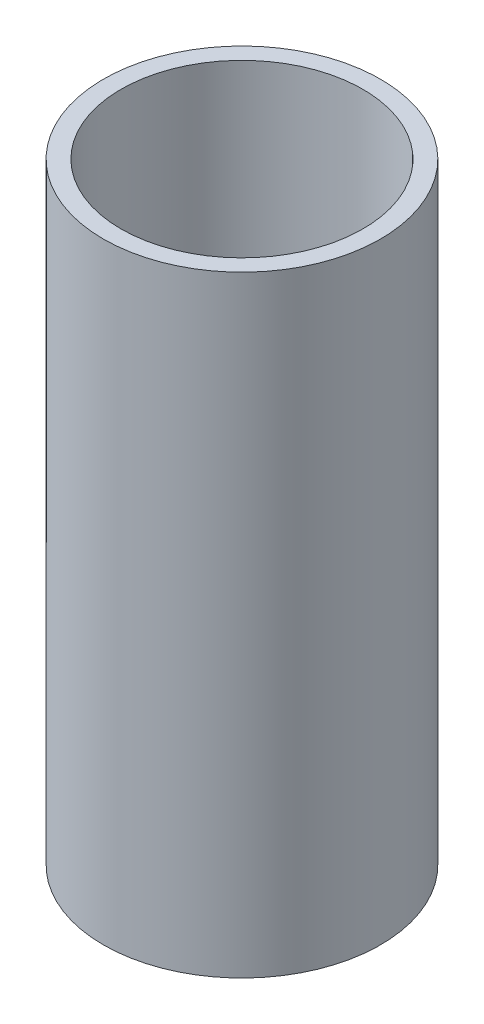
from build123d import *

# Parameters (mm, degrees)
SKETCH1_R           = 7.025
SKETCH1_R_2         = 6.135
BOSS_EXTRUDE1_DEPTH = 31


with BuildPart() as part:
    # Sketch1 → Boss-Extrude1 (new body)
    with BuildSketch(Plane(origin=(0, 0, 0), x_dir=(1, 0, 0), z_dir=(0, 1, 0))):
        with Locations(Location((0, 0, 0), (0, 0, 270))):
            Circle(SKETCH1_R)
        with Locations(Location((0, 0, 0), (0, 0, 270))):
            Circle(SKETCH1_R_2, mode=Mode.SUBTRACT)
    extrude(amount=BOSS_EXTRUDE1_DEPTH)


solid = part.part
